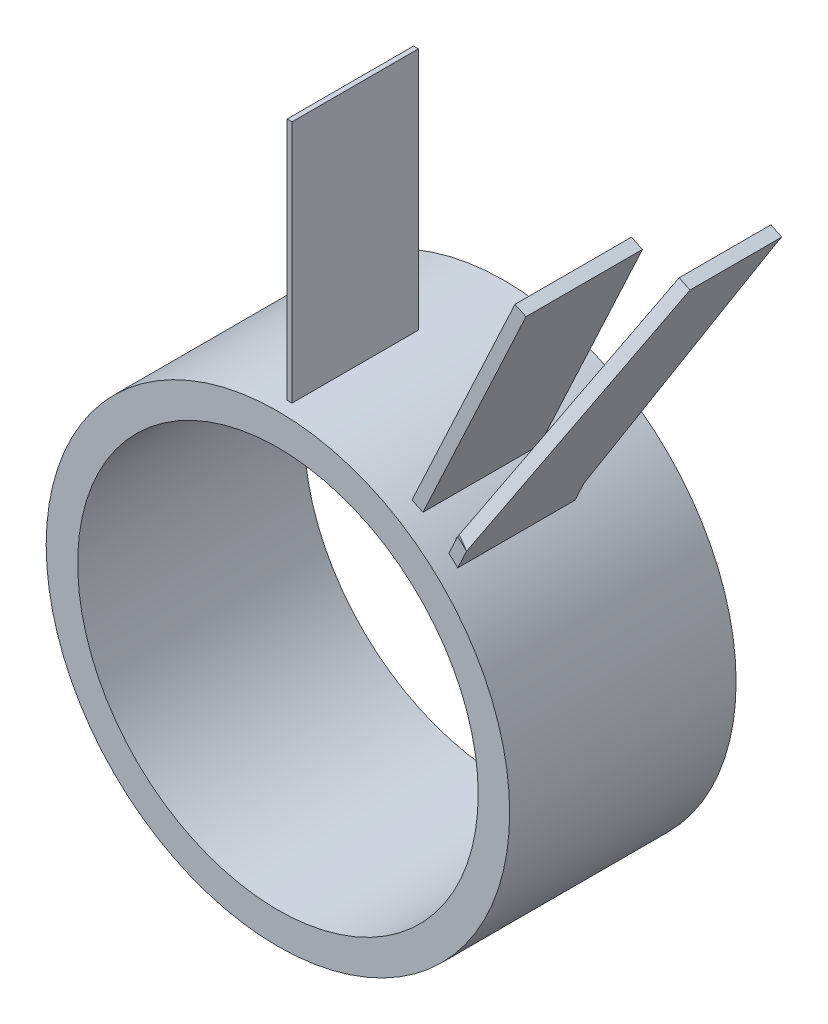
from build123d import *

# Parameters (mm, degrees)
SKETCH1_R                  = 34.054831914
SKETCH1_R_2                = 29.431915089
BOSS_EXTRUDE1_DEPTH        = 33.274
SKETCH2_W                  = 0.720665425
SKETCH2_H                  = 18.579229957
BOSS_EXTRUDE2_DEPTH        = 35.814
SKETCH4_W                  = 17.113974723
SKETCH4_H                  = 1.791098965
BOSS_EXTRUDE3_DEPTH        = 35.814
BOSS_EXTRUDE4_REACH        = 92.619
BOSS_EXTRUDE4_START_RADIUS = 34.054831914
BOSS_EXTRUDE4_END_RADIUS   = 34.054831914
SKETCH5_W                  = 17.220704339
SKETCH5_H                  = 1.700810305
BOSS_EXTRUDE5_DEPTH        = 1.778


with BuildPart() as part:
    # Sketch1 → Boss-Extrude1 (new body)
    with BuildSketch(Plane.XY):
        Circle(SKETCH1_R)
        Circle(SKETCH1_R_2, mode=Mode.SUBTRACT)
    extrude(amount=BOSS_EXTRUDE1_DEPTH)

    # Sketch2 → Boss-Extrude2 (add)
    with BuildSketch(Plane(origin=(0, 34.036, 0), x_dir=(1, 0, 0), z_dir=(0, 1, 0))):
        with Locations((-0.360332713, -21.913565349)):
            Rectangle(SKETCH2_W, SKETCH2_H)
    extrude(amount=BOSS_EXTRUDE2_DEPTH)



with BuildPart() as body_2:
    # Sketch4 → Boss-Extrude3 (new body)
    with BuildSketch(Plane(origin=(14.392193867, 30.86415935, 0), x_dir=(0, 0, -1), z_dir=(0.4226182617407033, 0.9063077870366482, 0))):
        with Locations((-21.834219148, -3.569625748)):
            Rectangle(SKETCH4_W, SKETCH4_H)
    extrude(amount=BOSS_EXTRUDE3_DEPTH)


with BuildPart() as body_3:
    # Boss-Extrude4: from a cylinder face, 92.619 long prism both ways, kept between that surface and its translate by the depth
    boss_extrude4_start = Plane(origin=(0, 0, 21.85282), z_dir=(0, 0, -1)) * Cylinder(BOSS_EXTRUDE4_START_RADIUS, 254.347663828, mode=Mode.PRIVATE)
    boss_extrude4_end = Plane(origin=(1.288140462, 2.762426135, 21.85282), z_dir=(0, 0, -1)) * Cylinder(BOSS_EXTRUDE4_END_RADIUS, 254.347663828, mode=Mode.PRIVATE)
    # Sketch5 → Boss-Extrude4 (new, from a surface)
    with BuildSketch(Plane(origin=(14.392193867, 30.86415935, 0), x_dir=(0, 0, -1), z_dir=(0.4226182617407033, 0.9063077870366482, 0)), mode=Mode.PRIVATE) as boss_extrude4_sk1:
        with Locations((-21.852819757, -10.19414928)):
            Rectangle(SKETCH5_W, SKETCH5_H)
    boss_extrude4_tool1 = extrude(boss_extrude4_sk1.sketch, amount=BOSS_EXTRUDE4_REACH, both=True, mode=Mode.PRIVATE)
    add(((boss_extrude4_tool1 - boss_extrude4_start) & boss_extrude4_end).solids().sort_by_distance((23.610178, 26.510778, 21.85282))[0])


with BuildPart() as part_1:
    add(part.part)

    add(body_3.part)  # Boss-Extrude5 merges body 3
    # Sketch6 → Boss-Extrude5 (add)
    with BuildSketch(Plane(origin=(10.009765687, -4.667630396, 0), x_dir=(0, 0, -1), z_dir=(0.9063077870366482, -0.42261826174070344, 0))):
        Polygon((-30.463171926, 35.262117931), (-13.242467587, 35.262117931), (0.550508704, 68.902638998), (1.163427563, 70.040916879), (-12.320787341, 70.040916879), align=None)
    extrude(amount=-BOSS_EXTRUDE5_DEPTH)


solid = Compound([body_2.part, part_1.part])
